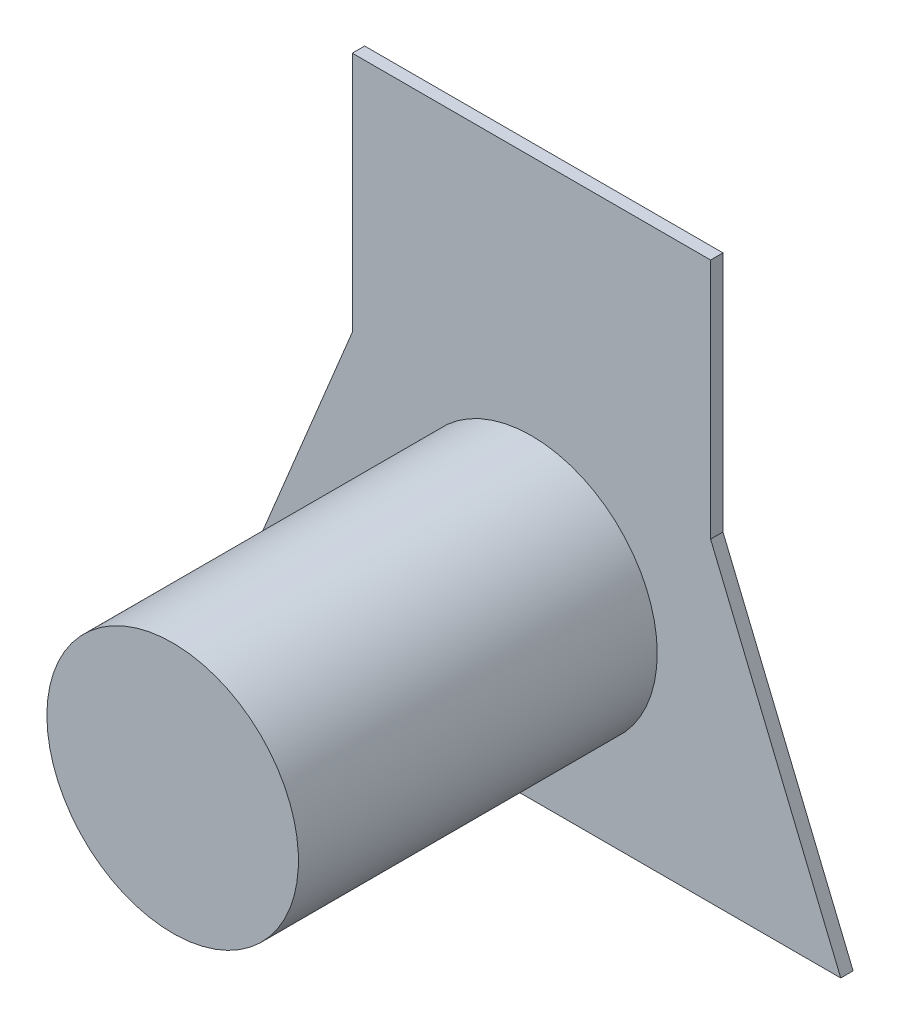
from build123d import *

# Parameters (mm, degrees)
EXTRUDE_1_DEPTH = 2
SKETCH_3_R      = 20.333518405
EXTRUDE_2_DEPTH = 60


with BuildPart() as part:
    # 草图1 → 凸台-拉伸1 (new body)
    with BuildSketch(Plane.XY):
        Polygon((-50, 0), (-28.960949348, 50.922075999), (-28.960949348, 90), (28.960949348, 90), (28.960949348, 50.922075999), (50, 0), align=None)
    extrude(amount=EXTRUDE_1_DEPTH)

    # 草图3 → 凸台-拉伸2 (add)
    with BuildSketch(Plane(origin=(0, 0, 0), x_dir=(-1, 0, 0), z_dir=(0, 0, -1))):
        with Locations((0, 30.596151571)):
            Circle(SKETCH_3_R)
    extrude(amount=-EXTRUDE_2_DEPTH)


solid = part.part
